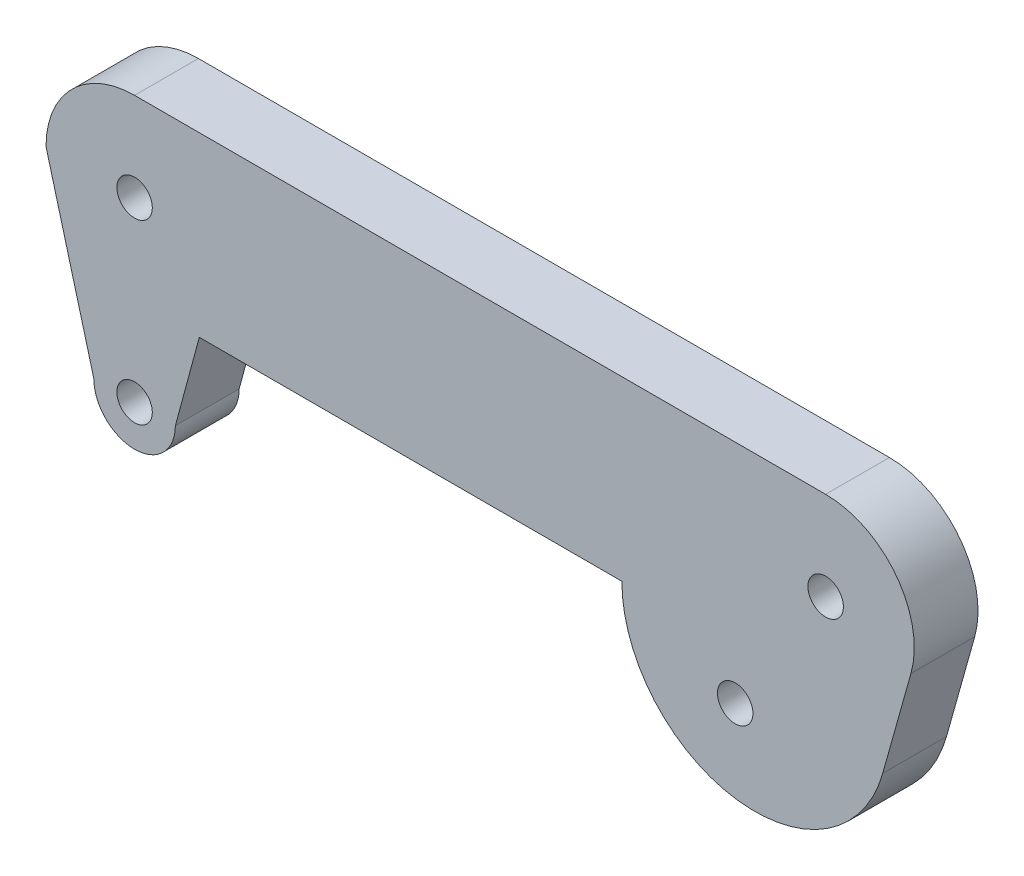
from build123d import *

# Parameters (mm, degrees)
SKETCH1_R           = 1
BOSS_EXTRUDE1_DEPTH = 3.6


with BuildPart() as part:
    # Sketch1 → Boss-Extrude1 (new body)
    with BuildSketch(Plane.XY):
        with BuildLine():
            Line((0, 5), (39, 5))
            ThreePointArc((39, 5), (42.984713636, 3.020274365), (43.813971379, -1.351177103))
            Line((43.813971379, -1.351177103), (42.220957068, -7.026765655))
            ThreePointArc((42.220957068, -7.026765655), (33.977057678, -12.429911776), (27.5, -5))
            Line((27.5, -5), (3.651745661, -5))
            Line((3.651745661, -5), (2.3, -10))
            ThreePointArc((2.3, -10), (0, -12.3), (-2.3, -10))
            Line((-2.3, -10), (-4.999999906, -0.00096864))
            ThreePointArc((-4.999999906, -0.00096864), (-3.535876355, 3.535191424), (0, 5))
        make_face()
        with Locations((0, -10)):
            Circle(SKETCH1_R, mode=Mode.SUBTRACT)
        Circle(SKETCH1_R, mode=Mode.SUBTRACT)
        with Locations((39, 0)):
            Circle(SKETCH1_R, mode=Mode.SUBTRACT)
        with Locations((33.8952959, -7.766976867)):
            Circle(SKETCH1_R, mode=Mode.SUBTRACT)
    extrude(amount=BOSS_EXTRUDE1_DEPTH)


solid = part.part
